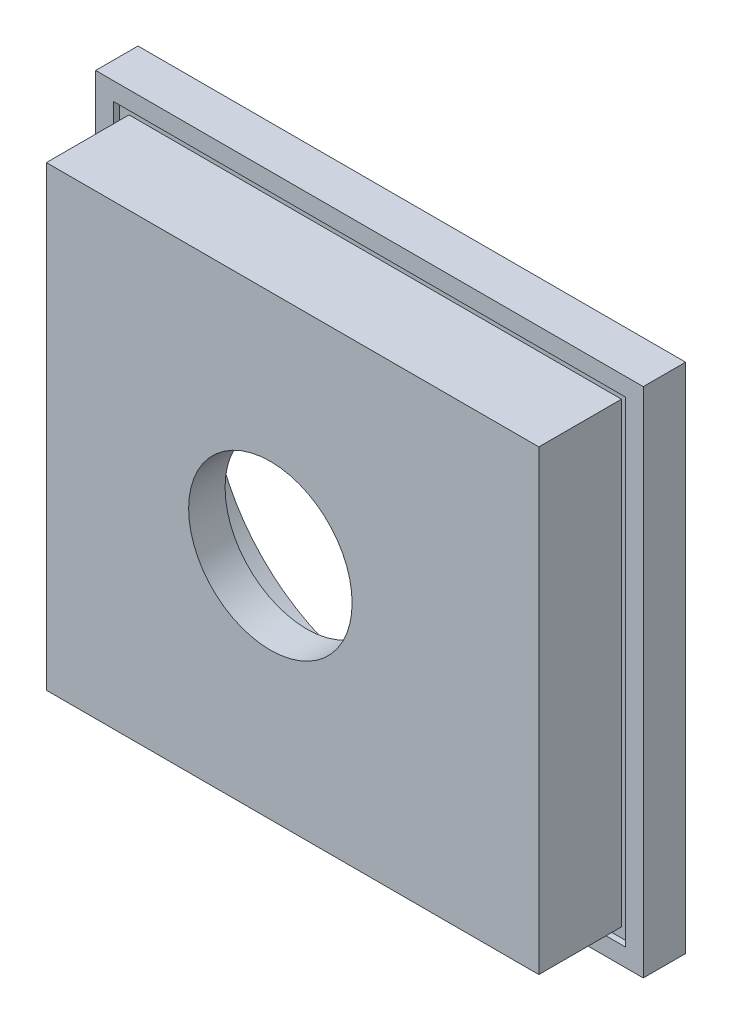
from build123d import *

# Parameters (mm, degrees)
SKETCH1_W                 = 278
SKETCH1_H                 = 260
BOSS_EXTRUDE1_DEPTH       = 60.5
SKETCH2_R                 = 90.5
CUT_EXTRUDE2_DEPTH        = 42
SKETCH3_R                 = 41.5
CUT_EXTRUDE3_DEPTH        = 386.414387381
SKETCH4_R                 = 99.95
SKETCH4_R_2               = 95.05
CUT_EXTRUDE5_DEPTH        = 2.95
SKETCH6_W                 = 278
SKETCH6_H                 = 260
SKETCH6_W_2               = 250
SKETCH6_H_2               = 232
CUT_EXTRUDE6_DEPTH        = 39
SKETCH7_W                 = 259.8
SKETCH7_H                 = 241.8
SKETCH7_W_2               = 250
SKETCH7_H_2               = 232
CUT_EXTRUDE7_DEPTH        = 41.95
F_8_0MM_DOWEL_HOLE1_D     = 8
F_8_0MM_DOWEL_HOLE1_DEPTH = 15
F_8_0MM_DOWEL_HOLE1_TIP   = 2.403442476
SKETCH10_R                = 3
CUT_EXTRUDE8_DEPTH        = 59


with BuildPart() as part:
    # Sketch1 → Boss-Extrude1 (new body)
    with BuildSketch(Plane.XY):
        with Locations((139, 130)):
            Rectangle(SKETCH1_W, SKETCH1_H)
    extrude(amount=BOSS_EXTRUDE1_DEPTH)

    # Sketch2 → Cut-Extrude2 (cut)
    with BuildSketch(Plane.XY):
        with Locations(Location((127.7, 130, 0), (0, 0, 180))):
            Circle(SKETCH2_R)
    extrude(amount=CUT_EXTRUDE2_DEPTH, mode=Mode.SUBTRACT)

    # Sketch3 → Cut-Extrude3 (cut, through all)
    with BuildSketch(Plane.XY):
        with Locations((127.7, 130)):
            Circle(SKETCH3_R)
    extrude(amount=CUT_EXTRUDE3_DEPTH, mode=Mode.SUBTRACT)

    # Sketch4 → Cut-Extrude5 (cut)
    with BuildSketch(Plane.XY):
        with Locations((127.7, 130)):
            Circle(SKETCH4_R)
        with Locations((127.7, 130)):
            Circle(SKETCH4_R_2, mode=Mode.SUBTRACT)
    extrude(amount=CUT_EXTRUDE5_DEPTH, mode=Mode.SUBTRACT)

    # Sketch6 → Cut-Extrude6 (cut)
    with BuildSketch(Plane.XY.offset(60.5)):
        with Locations((139, 130)):
            Rectangle(SKETCH6_W, SKETCH6_H)
        with Locations((139, 130)):
            Rectangle(SKETCH6_W_2, SKETCH6_H_2, mode=Mode.SUBTRACT)
    extrude(amount=-CUT_EXTRUDE6_DEPTH, mode=Mode.SUBTRACT)

    # Sketch7 → Cut-Extrude7 (cut)
    with BuildSketch(Plane.XY.offset(60.5)):
        with Locations((139, 130)):
            Rectangle(SKETCH7_W, SKETCH7_H)
        with Locations((139, 130)):
            Rectangle(SKETCH7_W_2, SKETCH7_H_2, mode=Mode.SUBTRACT)
    extrude(amount=-CUT_EXTRUDE7_DEPTH, mode=Mode.SUBTRACT)

    # Ø8.0mm Dowel Hole1
    with Locations(Plane(origin=(0, 0, 0), x_dir=(-1, 0, 0), z_dir=(0, 0, -1))):
        with Locations((-181.45, 223.097730907), (-77.93104653, 225.285367557), (-20.2, 130), (-73.95, 36.902269093), (-181.45, 36.902269093), (-235.2, 130)):
            Hole(F_8_0MM_DOWEL_HOLE1_D / 2, depth=F_8_0MM_DOWEL_HOLE1_DEPTH)
            with Locations((0, 0, -(F_8_0MM_DOWEL_HOLE1_DEPTH + F_8_0MM_DOWEL_HOLE1_TIP / 2))):  # 118° drill point
                Cone(0, F_8_0MM_DOWEL_HOLE1_D / 2, F_8_0MM_DOWEL_HOLE1_TIP, mode=Mode.SUBTRACT)

    # Sketch10 → Cut-Extrude8 (cut)
    with BuildSketch(Plane(origin=(0, 0, 0), x_dir=(1, 0, 0), z_dir=(0, 1, 0))):
        with Locations(Location((127.7, -9, 0), (0, 0, 90))):
            Circle(SKETCH10_R)
    extrude(amount=CUT_EXTRUDE8_DEPTH, mode=Mode.SUBTRACT)


solid = part.part
